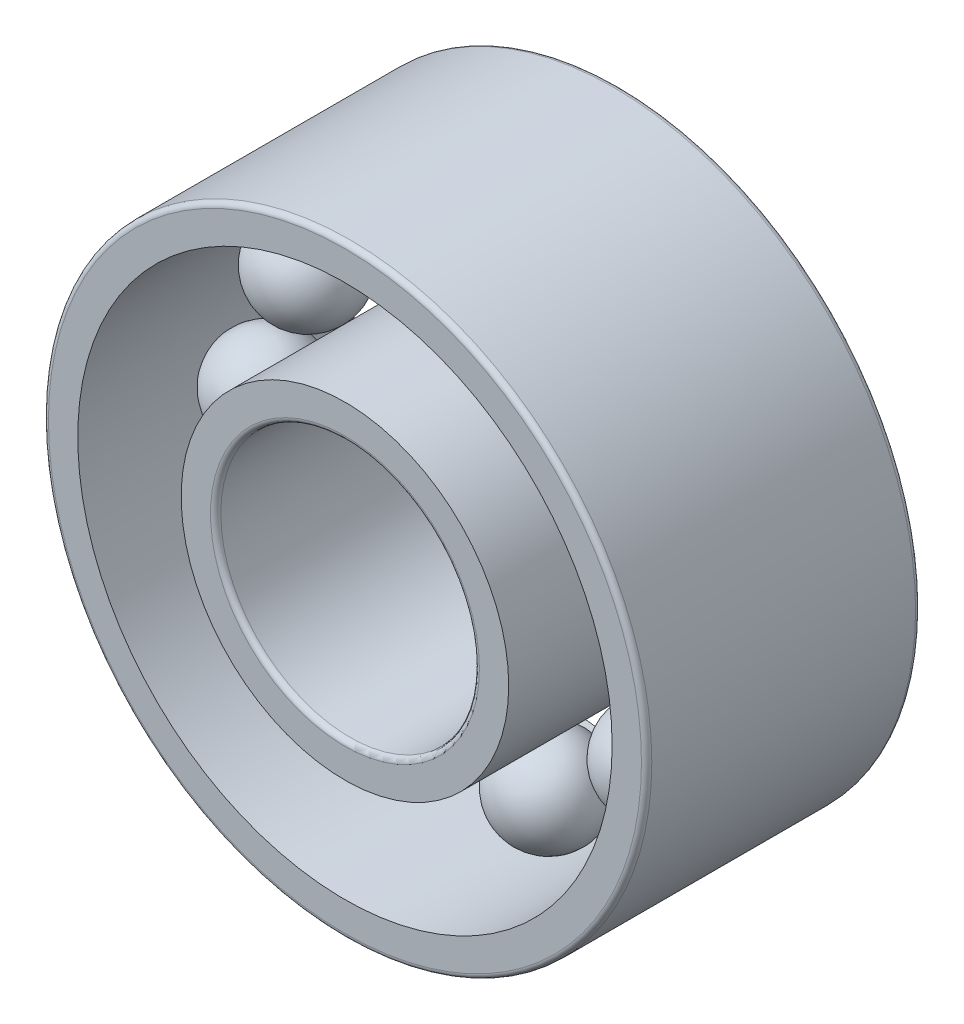
from build123d import *

# Parameters (mm, degrees)
INNERS_W           = 2
INNERS_H           = 15.9
OUTERS_W           = 2
OUTERS_H           = 15.9
BALLSPATTERN_COUNT = 10
FILLET_F1_R        = 0.3
FILLET_F2_R        = 0.3


with BuildPart() as part:
    # InnerS → InnerRing (revolve)
    with BuildSketch(Plane(origin=(0, 0, 0), x_dir=(1, 0, 0), z_dir=(0, 1, 0))):
        with Locations((8.5, 0)):
            Rectangle(INNERS_W, INNERS_H)
    revolve(axis=Axis((0, 0, 12.925), (0, 0, -1)))

    # Fillet F2
    fillet_f2_edges = [part.edges().sort_by_distance(p)[0] for p in [
        (-7.5, 0, -7.95),
        (-7.5, 0, 7.95),
    ]]
    fillet(fillet_f2_edges, radius=FILLET_F2_R)


with BuildPart() as body_2:
    # OuterS → OuterRing (revolve)
    with BuildSketch(Plane(origin=(0, 0, 0), x_dir=(1, 0, 0), z_dir=(0, 1, 0))):
        with Locations((16.5, 0)):
            Rectangle(OUTERS_W, OUTERS_H)
    revolve(axis=Axis((0, 0, 12.925), (0, 0, -1)))

    # Fillet F1
    fillet_f1_edges = [body_2.edges().sort_by_distance(p)[0] for p in [
        (-17.5, 0, -7.95),
        (-17.5, 0, 7.95),
    ]]
    fillet(fillet_f1_edges, radius=FILLET_F1_R)


with BuildPart() as body_3:
    # BallS → Ball (revolve)
    with BuildSketch(Plane(origin=(0, 0, 0), x_dir=(1, 0, 0), z_dir=(0, 1, 0))):
        with BuildLine():
            Line((9.65, 0), (15.35, 0))
            ThreePointArc((15.35, 0), (12.5, -2.85), (9.65, 0))
        make_face()
    revolve(axis=Axis((9.65, 0, 0), (1, 0, 0)))


with BuildPart() as ballspattern_1:
    # BallsPattern: pattern copy
    add(body_3.part.rotate(Axis((0, 0, -8.745), (0, 0, 1)), 1 * 360 / BALLSPATTERN_COUNT))


with BuildPart() as ballspattern_2:
    # BallsPattern: pattern copy
    add(body_3.part.rotate(Axis((0, 0, -8.745), (0, 0, 1)), 2 * 360 / BALLSPATTERN_COUNT))


with BuildPart() as ballspattern_3:
    # BallsPattern: pattern copy
    add(body_3.part.rotate(Axis((0, 0, -8.745), (0, 0, 1)), 3 * 360 / BALLSPATTERN_COUNT))


with BuildPart() as ballspattern_4:
    # BallsPattern: pattern copy
    add(body_3.part.rotate(Axis((0, 0, -8.745), (0, 0, 1)), 4 * 360 / BALLSPATTERN_COUNT))


with BuildPart() as ballspattern_5:
    # BallsPattern: pattern copy
    add(body_3.part.rotate(Axis((0, 0, -8.745), (0, 0, 1)), 5 * 360 / BALLSPATTERN_COUNT))


with BuildPart() as ballspattern_6:
    # BallsPattern: pattern copy
    add(body_3.part.rotate(Axis((0, 0, -8.745), (0, 0, 1)), 6 * 360 / BALLSPATTERN_COUNT))


with BuildPart() as ballspattern_7:
    # BallsPattern: pattern copy
    add(body_3.part.rotate(Axis((0, 0, -8.745), (0, 0, 1)), 7 * 360 / BALLSPATTERN_COUNT))


with BuildPart() as ballspattern_8:
    # BallsPattern: pattern copy
    add(body_3.part.rotate(Axis((0, 0, -8.745), (0, 0, 1)), 8 * 360 / BALLSPATTERN_COUNT))


with BuildPart() as ballspattern_9:
    # BallsPattern: pattern copy
    add(body_3.part.rotate(Axis((0, 0, -8.745), (0, 0, 1)), 9 * 360 / BALLSPATTERN_COUNT))


solid = Compound([part.part, body_2.part, body_3.part, ballspattern_1.part, ballspattern_2.part, ballspattern_3.part, ballspattern_4.part, ballspattern_5.part, ballspattern_6.part, ballspattern_7.part, ballspattern_8.part, ballspattern_9.part])
